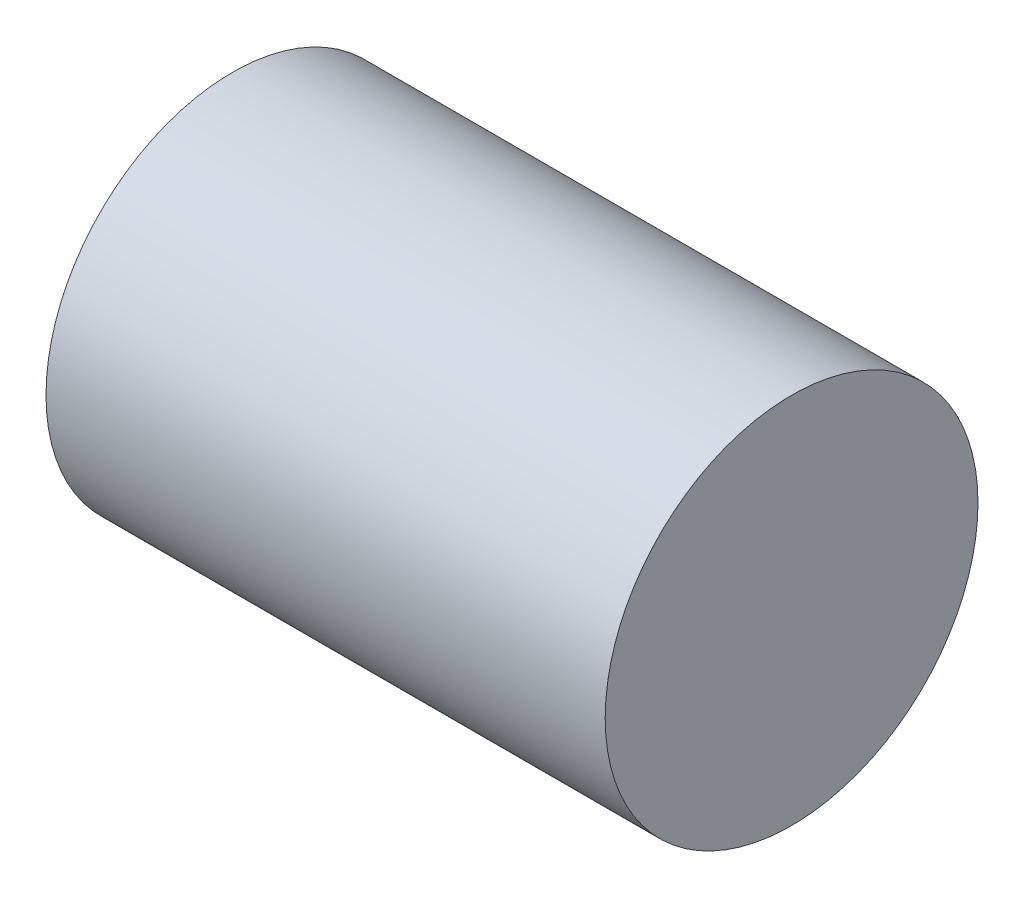
from build123d import *

# Parameters (mm, degrees)
SKETCH1_R           = 6.35
BOSS_EXTRUDE1_DEPTH = 19.05


with BuildPart() as part:
    # Sketch1 → Boss-Extrude1 (new body)
    with BuildSketch(Plane(origin=(0, 0, 0), x_dir=(0, 0, -1), z_dir=(1, 0, 0))):
        Circle(SKETCH1_R)
    extrude(amount=BOSS_EXTRUDE1_DEPTH)


solid = part.part
